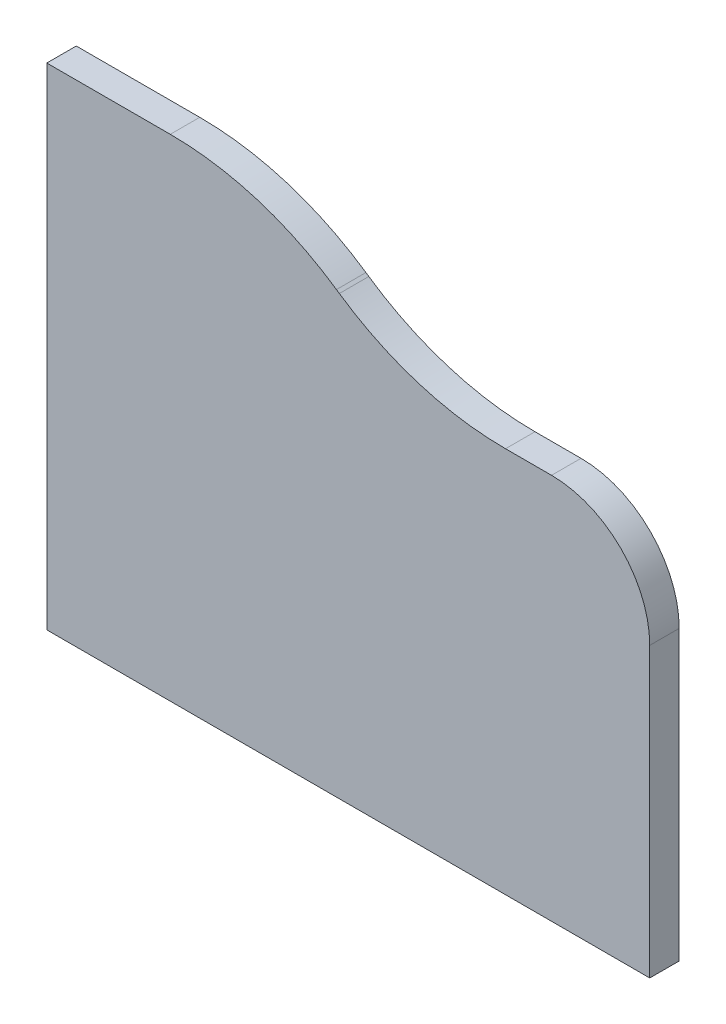
from build123d import *

# Parameters (mm, degrees)
SALIENTE_EXTRUIR1_DEPTH = 6


with BuildPart() as part:
    # Croquis1 → Saliente-Extruir1 (new body)
    with BuildSketch(Plane.XY):
        with BuildLine():
            Line((-61.687836697, -25), (61.127779513, -25))
            Line((61.127779513, -25), (61.127779513, 33.677530069))
            ThreePointArc((61.127779513, 33.677530069), (55.269915137, 47.819665693), (41.127779513, 53.677530069))
            Line((41.127779513, 53.677530069), (31.753958615, 53.677530069))
            ThreePointArc((31.753958615, 53.677530069), (14.040005801, 56.352004553), (-2.094763185, 64.137000878))
            Line((-2.094763185, 64.137000878), (-2.685361739, 64.540529191))
            ThreePointArc((-2.685361739, 64.540529191), (-18.820130726, 72.325525516), (-36.534083539, 75))
            Line((-36.534083539, 75), (-61.687836697, 75))
            Line((-61.687836697, 75), (-61.687836697, -25))
        make_face()
    extrude(amount=SALIENTE_EXTRUIR1_DEPTH)


solid = part.part
